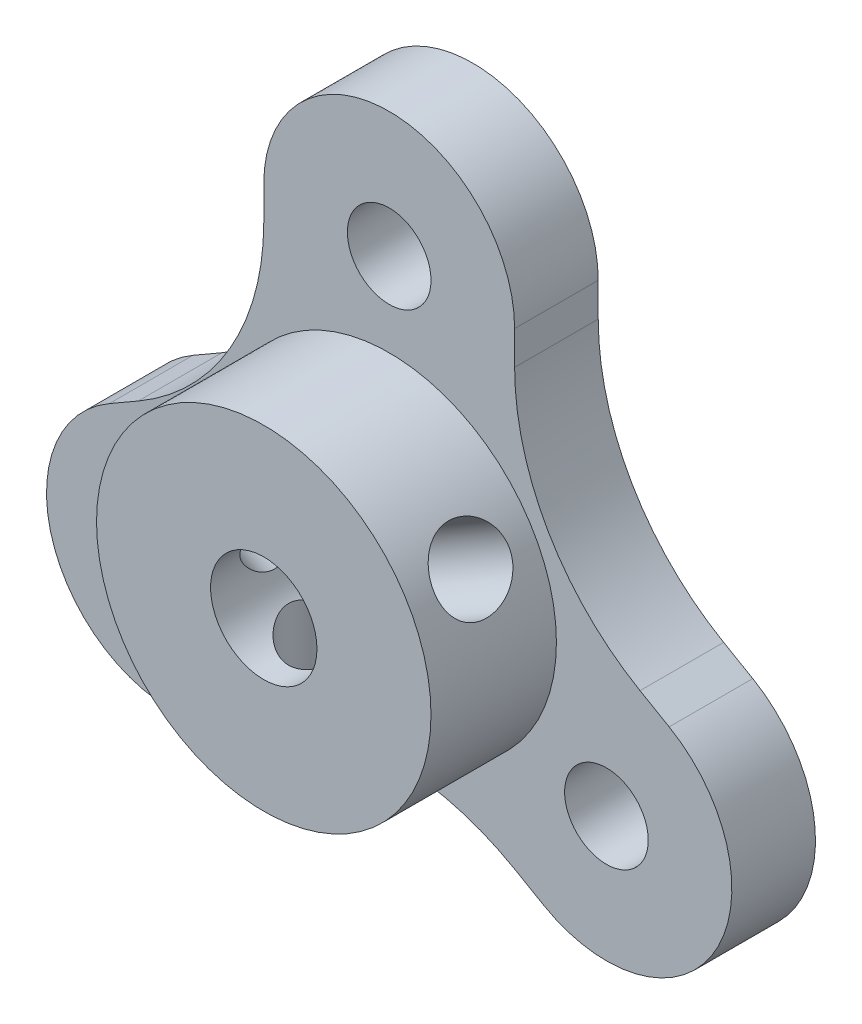
from build123d import *

# Parameters (mm, degrees)
F_1_8_0_1250_DOWEL_HOLE1_D = 3.175
SKETCH6_W                  = 1.4351
SKETCH6_H                  = 21.685653285
CIRPATTERN1_COUNT          = 3
CIRPATTERN2_COUNT          = 3
CUT_EXTRUDE1_START         = -10
SKETCH7_R                  = 15.875
CUT_EXTRUDE1_DEPTH         = 10


with BuildPart() as part:
    # Sketch1 → Revolve1 (revolve)
    with BuildSketch(Plane(origin=(0, 0, 0), x_dir=(0, 0, -1), z_dir=(1, 0, 0)), mode=Mode.PRIVATE) as revolve1_sk:
        Polygon((0, 2.0193), (0, 6.35), (4.7625, 6.35), (4.7625, 15.875), (7.9375, 15.875), (7.9375, 2.0193), align=None)
    revolve(revolve1_sk.sketch.rotate(Axis((0, 0, 0), (0, 0, -1)), 90), axis=Axis((0, 0, 0), (0, 0, -1)))

    # 1/8 (0.1250) Dowel Hole1 (through all)
    with Locations(Plane.XY.offset(-4.7625)):
        with Locations((0, 9.525), (0, 0)):
            f_1_8_0_1250_dowel_hole1 = Hole(F_1_8_0_1250_DOWEL_HOLE1_D / 2)

    # Sketch6 → #6-40 Tapped Hole1 (revolve, cut)
    with BuildSketch(Plane(origin=(0, 0, -2.38125), x_dir=(0, 0, 1), z_dir=(1, 0, 0))):
        with Locations((0.71755, 10.842826643)):
            Rectangle(SKETCH6_W, SKETCH6_H)
    f_6_40_tapped_hole1 = revolve(axis=Axis((0, 6.35, -2.38125), (0, -1, 0)), mode=Mode.SUBTRACT)

    # CirPattern1: #6-40 Tapped Hole1 ×3 about axis
    cirpattern1_axis = Axis((0, 0, 0), (0, 0, 1))
    for i in range(1, CIRPATTERN1_COUNT):
        add(f_6_40_tapped_hole1.rotate(cirpattern1_axis, i * 360 / CIRPATTERN1_COUNT), mode=Mode.SUBTRACT)

    # CirPattern2: 1/8 (0.1250) Dowel Hole1 ×3 about axis
    cirpattern2_axis = Axis((0, 0, 0), (0, 0, 1))
    for i in range(1, CIRPATTERN2_COUNT):
        add(f_1_8_0_1250_dowel_hole1.rotate(cirpattern2_axis, i * 360 / CIRPATTERN2_COUNT), mode=Mode.SUBTRACT)

    # Sketch7 → Cut-Extrude1 (cut)
    with BuildSketch(Plane.XY.offset(-4.7625).offset(CUT_EXTRUDE1_START)):
        Circle(SKETCH7_R)
        with BuildLine():
            ThreePointArc((-4.7625, 9.525), (0, 14.2875), (4.7625, 9.525))
            Line((4.7625, 9.525), (4.7625, 8.248891971))
            ThreePointArc((4.7625, 8.248891971), (6.038608029, 3.486391971), (9.525, 0))
            Line((9.525, 0), (10.630141971, -0.638054014))
            ThreePointArc((10.630141971, -0.638054014), (12.373337957, -7.14375), (5.867641971, -8.886945986))
            Line((5.867641971, -8.886945986), (4.7625, -8.248891971))
            ThreePointArc((4.7625, -8.248891971), (0, -6.972783942), (-4.7625, -8.248891971))
            Line((-4.7625, -8.248891971), (-5.867641971, -8.886945986))
            ThreePointArc((-5.867641971, -8.886945986), (-12.373337957, -7.14375), (-10.630141971, -0.638054014))
            Line((-10.630141971, -0.638054014), (-9.525, 0))
            ThreePointArc((-9.525, 0), (-6.038608029, 3.486391971), (-4.7625, 8.248891971))
            Line((-4.7625, 8.248891971), (-4.7625, 9.525))
        make_face(mode=Mode.SUBTRACT)
    extrude(amount=CUT_EXTRUDE1_DEPTH, mode=Mode.SUBTRACT)


solid = part.part
